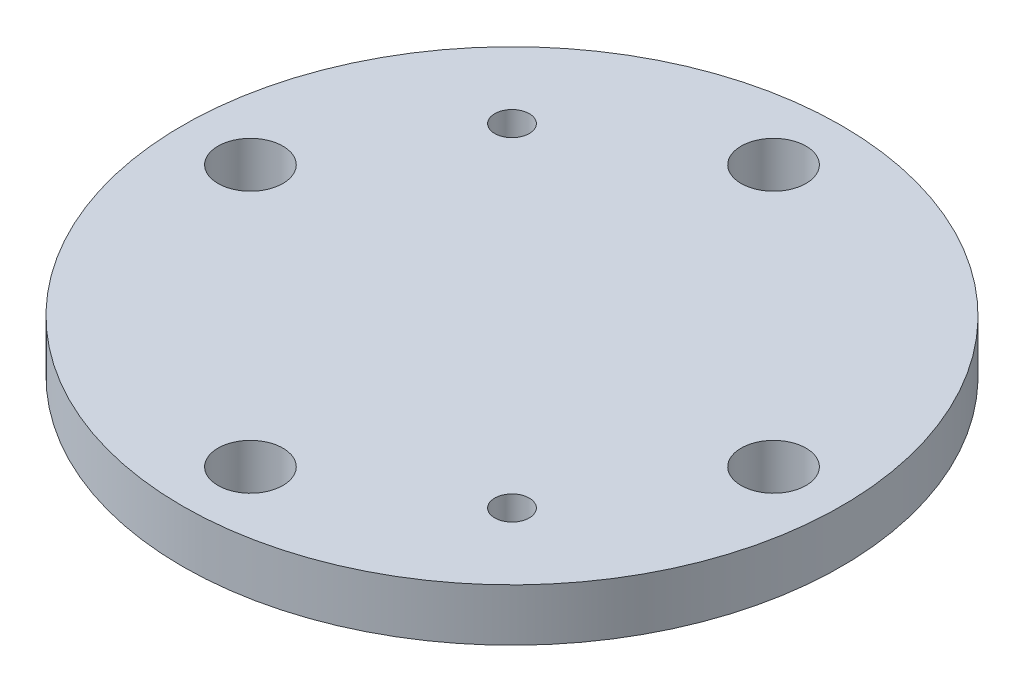
from build123d import *

# Parameters (mm, degrees)
SKETCH1_R           = 31.5
SKETCH1_R_2         = 3.1
SKETCH1_R_3         = 1.65
BOSS_EXTRUDE1_DEPTH = 5


with BuildPart() as part:
    # Sketch1 → Boss-Extrude1 (new body)
    with BuildSketch(Plane(origin=(0, 0, 0), x_dir=(1, 0, 0), z_dir=(0, 1, 0))):
        Circle(SKETCH1_R)
        with Locations((0, 25)):
            Circle(SKETCH1_R_2, mode=Mode.SUBTRACT)
        with Locations((25, 0)):
            Circle(SKETCH1_R_2, mode=Mode.SUBTRACT)
        with Locations((0, -25)):
            Circle(SKETCH1_R_2, mode=Mode.SUBTRACT)
        with Locations((-25, 0)):
            Circle(SKETCH1_R_2, mode=Mode.SUBTRACT)
        with Locations((-15.909902577, 15.909902577)):
            Circle(SKETCH1_R_3, mode=Mode.SUBTRACT)
        with Locations((15.909902577, -15.909902577)):
            Circle(SKETCH1_R_3, mode=Mode.SUBTRACT)
    extrude(amount=BOSS_EXTRUDE1_DEPTH)


solid = part.part
